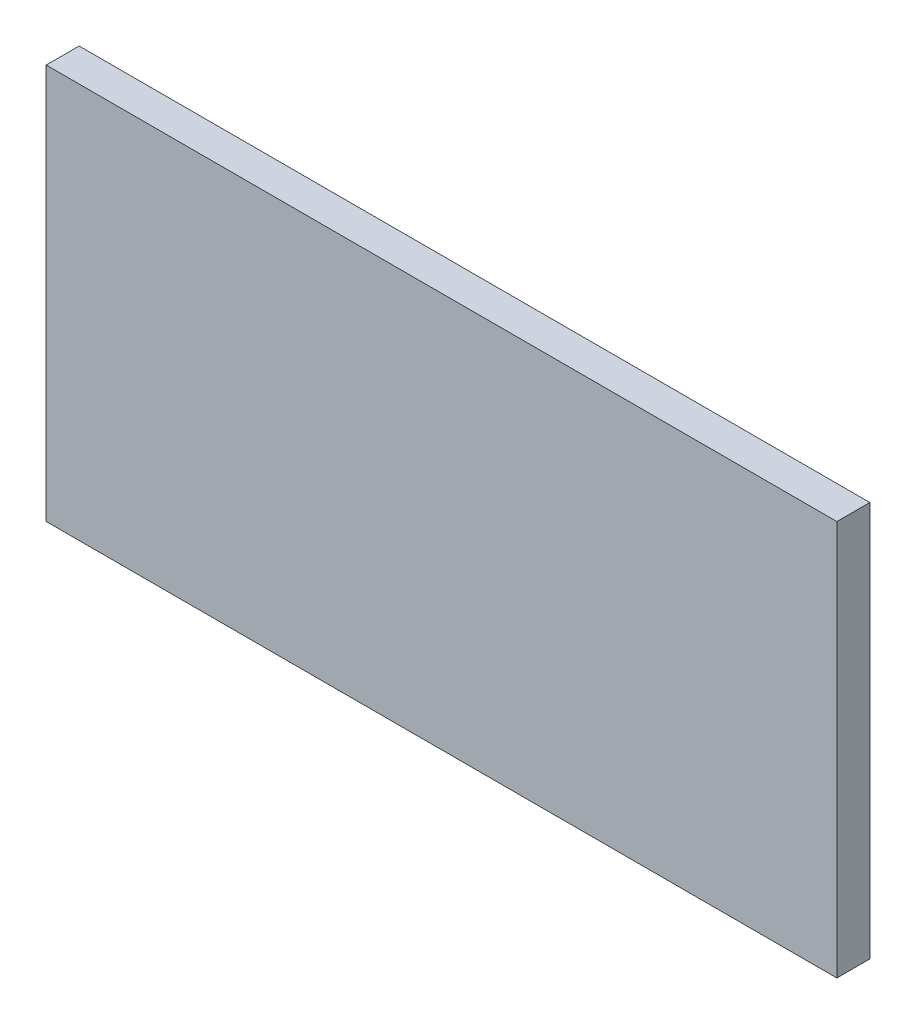
from build123d import *

# Parameters (mm, degrees)
SKETCH1_W           = 24
SKETCH1_H           = 12
BOSS_EXTRUDE1_DEPTH = 1


with BuildPart() as part:
    # Sketch1 → Boss-Extrude1 (new body)
    with BuildSketch(Plane.XY):
        with Locations((5.920529801, -0.496688742)):
            Rectangle(SKETCH1_W, SKETCH1_H)
    extrude(amount=BOSS_EXTRUDE1_DEPTH)


solid = part.part
